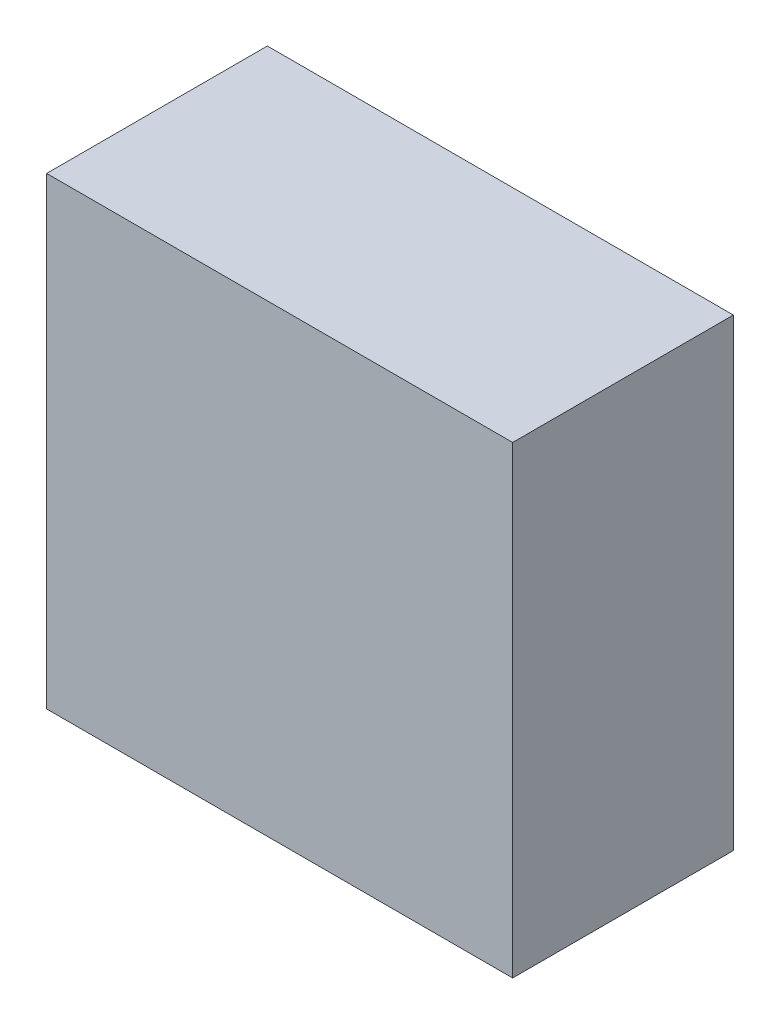
from build123d import *

# Parameters (mm, degrees)
SKETCH1_W               = 2.1115
SKETCH1_H               = 2.1016
COMPONENT_OUTLINE_DEPTH = 1


with BuildPart() as part:
    # Sketch1 → Component_Outline (new body)
    with BuildSketch(Plane.XY):
        with Locations((-0.0508, -0.0508)):
            Rectangle(SKETCH1_W, SKETCH1_H)
    extrude(amount=COMPONENT_OUTLINE_DEPTH)


solid = part.part
